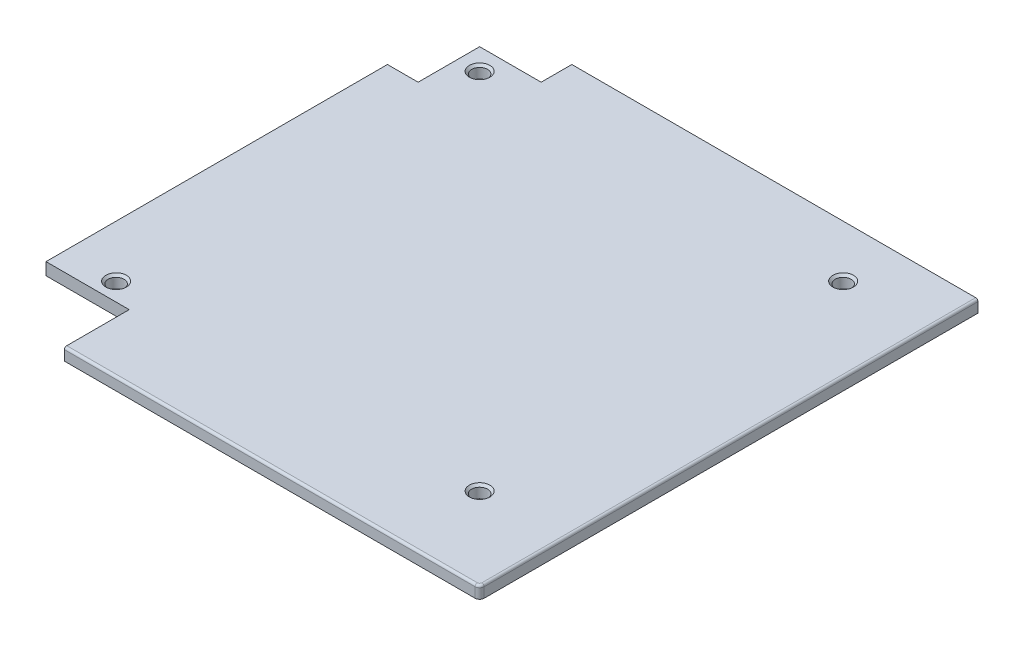
from build123d import *

# Parameters (mm, degrees)
SKETCH1_R           = 1.85
BOSS_EXTRUDE1_DEPTH = 2
CHAMFER2_SIZE       = 1.5
CUT_EXTRUDE2_START  = -2
SKETCH1_4_R         = 2.6
SKETCH1_4_R_2       = 1.85
CUT_EXTRUDE2_DEPTH  = 3.25
FILLET1_R           = 0.75


with BuildPart() as part:
    # Sketch1 → Boss-Extrude1 (new, symmetric)
    with BuildSketch(Plane(origin=(0, 0, 0), x_dir=(1, 0, 0), z_dir=(0, 1, 0))):
        with BuildLine():
            Line((-66.2, 46.15), (-76.2, 46.15))
            Line((-76.2, 46.15), (-76.2, -65.15))
            Line((-76.2, -65.15), (-49.08, -65.15))
            Line((-49.08, -65.15), (-49.08, -86.25))
            Line((-49.08, -86.25), (84.75, -86.25))
            ThreePointArc((84.75, -86.25), (85.810660172, -85.810660172), (86.25, -84.75))
            Line((86.25, -84.75), (86.25, 76.2))
            Line((86.25, 76.2), (-46.15, 76.2))
            Line((-46.15, 76.2), (-46.15, 66.2))
            Line((-46.15, 66.2), (-66.2, 66.2))
            Line((-66.2, 66.2), (-66.2, 46.15))
        make_face()
        with Locations(Location((-59.25, 59.25, 0), (0, 0, 270))):
            Circle(SKETCH1_R, mode=Mode.SUBTRACT)
        with Locations(Location((-59.25, -59.25, 0), (0, 0, 270))):
            Circle(SKETCH1_R, mode=Mode.SUBTRACT)
        with Locations(Location((59.25, -59.25, 0), (0, 0, 270))):
            Circle(SKETCH1_R, mode=Mode.SUBTRACT)
        with Locations(Location((59.25, 59.25, 0), (0, 0, 270))):
            Circle(SKETCH1_R, mode=Mode.SUBTRACT)
    extrude(amount=BOSS_EXTRUDE1_DEPTH, both=True)

    # Chamfer2
    chamfer2_edges = [part.edges().sort_by_distance(p)[0] for p in [
        (-59.25, 2, -61.1),
        (59.25, 2, -61.1),
        (59.25, 2, 57.4),
        (-59.25, 2, 57.4),
    ]]
    chamfer(chamfer2_edges, length=CHAMFER2_SIZE)

    # Sketch1<4> → Cut-Extrude2 (cut)
    # profile 1 of 4: a face of its own
    with BuildSketch(Plane(origin=(0, 0, 0), x_dir=(1, 0, 0), z_dir=(0, 1, 0)).offset(CUT_EXTRUDE2_START)):
        with Locations(Location((-59.25, 59.25, 0), (0, 0, 270))):
            Circle(SKETCH1_4_R)
        with Locations((-59.25, 59.25)):
            Circle(SKETCH1_4_R_2, mode=Mode.SUBTRACT)
    # profile 2 of 4: a face of its own
    with BuildSketch(Plane(origin=(0, 0, 0), x_dir=(1, 0, 0), z_dir=(0, 1, 0)).offset(CUT_EXTRUDE2_START)):
        with Locations(Location((-59.25, -59.25, 0), (0, 0, 270))):
            Circle(SKETCH1_4_R)
        with Locations((-59.25, -59.25)):
            Circle(SKETCH1_4_R_2, mode=Mode.SUBTRACT)
    # profile 3 of 4: a face of its own
    with BuildSketch(Plane(origin=(0, 0, 0), x_dir=(1, 0, 0), z_dir=(0, 1, 0)).offset(CUT_EXTRUDE2_START)):
        with Locations(Location((59.25, -59.25, 0), (0, 0, 270))):
            Circle(SKETCH1_4_R)
        with Locations((59.25, -59.25)):
            Circle(SKETCH1_4_R_2, mode=Mode.SUBTRACT)
    # profile 4 of 4: a face of its own
    with BuildSketch(Plane(origin=(0, 0, 0), x_dir=(1, 0, 0), z_dir=(0, 1, 0)).offset(CUT_EXTRUDE2_START)):
        with Locations(Location((59.25, 59.25, 0), (0, 0, 270))):
            Circle(SKETCH1_4_R)
        with Locations((59.25, 59.25)):
            Circle(SKETCH1_4_R_2, mode=Mode.SUBTRACT)
    extrude(amount=CUT_EXTRUDE2_DEPTH, mode=Mode.SUBTRACT)

    # Fillet1
    fillet1_edges = [part.edges().sort_by_distance(p)[0] for p in [
        (86.25, 2, 4.275),
        (17.835, 2, 86.25),
        (85.810660172, 2, 85.810660172),
    ]]
    fillet(fillet1_edges, radius=FILLET1_R)


solid = part.part
